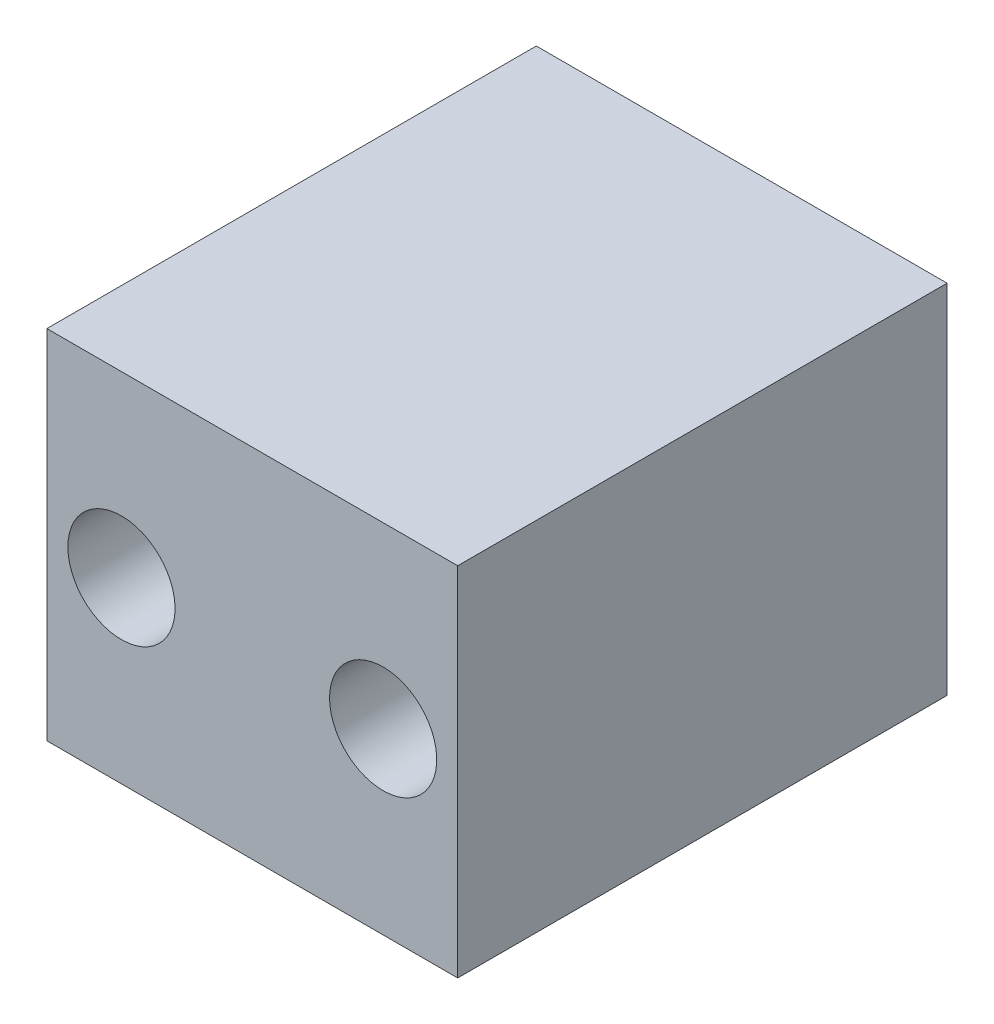
from build123d import *

# Parameters (mm, degrees)
SKETCH3_W           = 11.5
SKETCH3_H           = 9.994310106
SKETCH3_R           = 1.5
BOSS_EXTRUDE2_DEPTH = 13.7


with BuildPart() as part:
    # Sketch3 → Boss-Extrude2 (new body)
    with BuildSketch(Plane.XY):
        Rectangle(SKETCH3_W, SKETCH3_H)
        with Locations(Location((3.662514997, 0, 0), (0, 0, 180))):
            Circle(SKETCH3_R, mode=Mode.SUBTRACT)
        with Locations(Location((-3.662514997, 0, 0), (0, 0, 180))):
            Circle(SKETCH3_R, mode=Mode.SUBTRACT)
    extrude(amount=BOSS_EXTRUDE2_DEPTH)


solid = part.part
